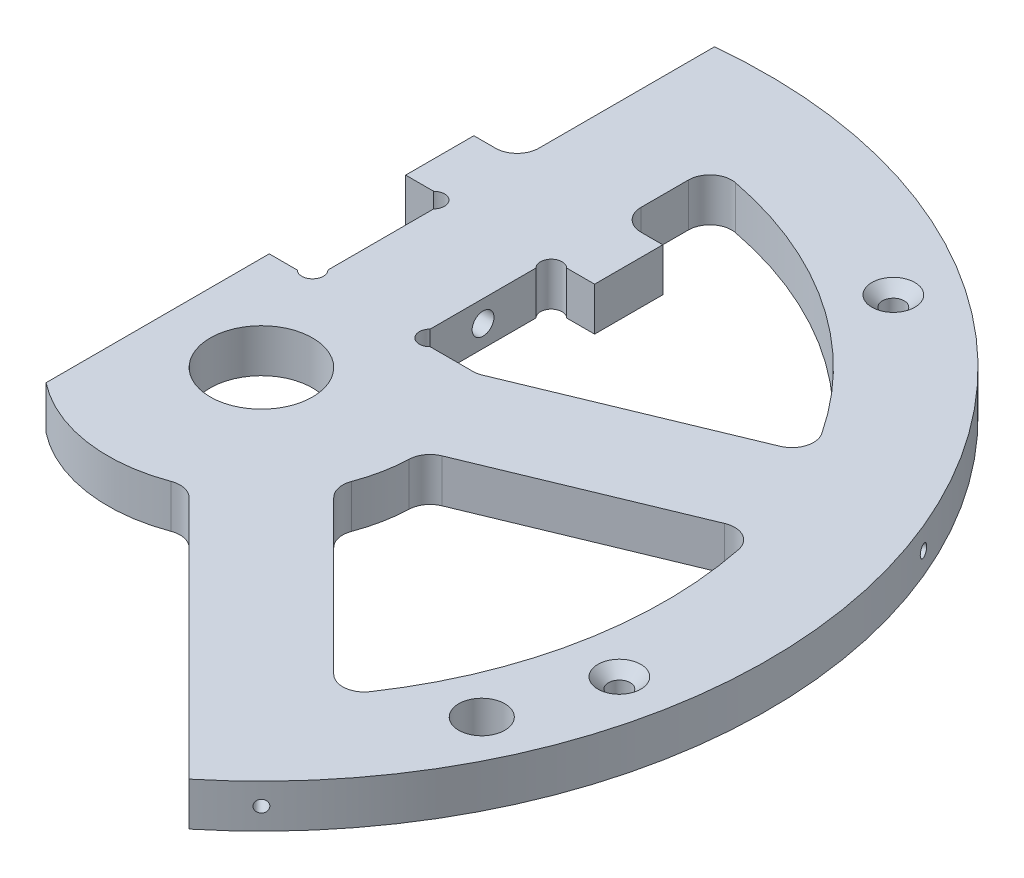
from build123d import *

# Parameters (mm, degrees)
SKETCH1_R                                       = 7.5
BOSS_EXTRUDE1_DEPTH                             = 3.175
CIRPATTERN1_COUNT                               = 3
CIRPATTERN1_ANGLE                               = 135
M3_CLEARANCE_HOLE1_D                            = 3.2
M3_CLEARANCE_HOLE1_DEPTH                        = 15
CSK_FOR_M3_FLAT_HEAD_MACHINE_SCREW1_D           = 3.2
CSK_FOR_M3_FLAT_HEAD_MACHINE_SCREW1_CSINK_D     = 6.3
CSK_FOR_M3_FLAT_HEAD_MACHINE_SCREW1_CSINK_ANGLE = 90
CUT_EXTRUDE1_REACH                              = 107.268
FILLET1_R                                       = 3.175
CUT_EXTRUDE2_REACH                              = 107.268
SKETCH11_W                                      = 9.65
SKETCH11_H                                      = 32.732103654
F_1_4_CLEARANCE_HOLE1_D                         = 6.7564


with BuildPart() as part:
    # Sketch1 → Boss-Extrude1 (new, symmetric)
    with BuildSketch(Plane(origin=(0, 0, 0), x_dir=(1, 0, 0), z_dir=(0, 1, 0))):
        with BuildLine():
            Line((-13.85, 35), (-7.5, 35))
            Line((-7.5, 35), (-7.5, 15))
            Line((-7.5, 15), (-16.770509831, 15))
            ThreePointArc((-16.770509831, 15), (-18.002512666, -13.496649128), (9.696699141, -20.303300859))
            Line((9.696699141, -20.303300859), (46.966384428, -57.572986146))
            ThreePointArc((46.966384428, -57.572986146), (68.644249266, 28.433379025), (-7.5, 73.920497834))
            Line((-7.5, 73.920497834), (-7.5, 45))
            Line((-7.5, 45), (-13.85, 45))
            Line((-13.85, 45), (-13.85, 35))
        make_face()
        with Locations(Location((0, 0, 0), (0, 0, 270))):
            Circle(SKETCH1_R, mode=Mode.SUBTRACT)
        with BuildLine():
            Line((20.303300859, -9.696699141), (46.898012061, -36.291410343))
            ThreePointArc((46.898012061, -36.291410343), (58.160567128, -11.568856096), (57.216234934, 15.581798996))
            Line((57.216234934, 15.581798996), (22.468570216, 1.188845008))
            ThreePointArc((22.468570216, 1.188845008), (22.067668809, -4.389532245), (20.303300859, -9.696699141))
        make_face(mode=Mode.SUBTRACT)
        with BuildLine():
            Line((7.5, 15), (7.5, 35))
            Line((7.5, 35), (13.85, 35))
            Line((13.85, 35), (13.85, 45))
            Line((13.85, 45), (7.5, 45))
            Line((7.5, 45), (7.5, 58.823804705))
            ThreePointArc((7.5, 58.823804705), (32.945314818, 49.30614801), (51.475983449, 29.439991983))
            Line((51.475983449, 29.439991983), (16.72831873, 15.047037996))
            Line((16.72831873, 15.047037996), (16.614758962, 15))
            Line((16.614758962, 15), (7.5, 15))
        make_face(mode=Mode.SUBTRACT)
    extrude(amount=BOSS_EXTRUDE1_DEPTH, both=True)

    # Sketch5 → M2.2x0.45 Tapped Hole1 (revolve, cut)
    with BuildSketch(Plane(origin=(0, 0, -74.3), x_dir=(0, 1, 0), z_dir=(1, 0, 0))):
        Polygon((0, 0), (0, 10.525753042), (0.875, 10), (0.875, 0), align=None)
    m2_2x0_45_tapped_hole1 = revolve(axis=Axis((0, 0, -80.65), (0, 0, 1)), mode=Mode.SUBTRACT)

    # CirPattern1: M2.2x0.45 Tapped Hole1 ×3 about axis
    cirpattern1_axis = Axis((0, 3.175, 0), (0, -1, 0))
    for i in range(1, CIRPATTERN1_COUNT):
        add(m2_2x0_45_tapped_hole1.rotate(cirpattern1_axis, i * CIRPATTERN1_ANGLE / (CIRPATTERN1_COUNT - 1)), mode=Mode.SUBTRACT)

    # M3 Clearance Hole1
    with Locations(Plane.ZY.offset(7.5)):
        with Locations((-25, 0)):
            Hole(M3_CLEARANCE_HOLE1_D / 2, depth=M3_CLEARANCE_HOLE1_DEPTH)

    # CSK for M3 Flat Head Machine Screw1 (through all)
    with Locations(Plane(origin=(0, 3.175, 0), x_dir=(1, 0, 0), z_dir=(0, 1, 0))):
        with Locations((65.516456731, -13.032033511), (37.112091566, 55.542170102)):
            CounterSinkHole(CSK_FOR_M3_FLAT_HEAD_MACHINE_SCREW1_D / 2, CSK_FOR_M3_FLAT_HEAD_MACHINE_SCREW1_CSINK_D / 2, counter_sink_angle=CSK_FOR_M3_FLAT_HEAD_MACHINE_SCREW1_CSINK_ANGLE)

    # Sketch10 → Cut-Extrude1 (cut, up to next)
    with BuildSketch(Plane(origin=(0, 3.175, 0), x_dir=(1, 0, 0), z_dir=(0, 1, 0)), mode=Mode.PRIVATE) as cut_extrude1_sk1:
        with BuildLine():
            Line((-8.622532015, 15), (-9.74506403, 15))
            ThreePointArc((-9.74506403, 15), (-8.622532015, 14.535032015), (-7.5, 15))
            Line((-7.5, 15), (-8.622532015, 15))
        make_face()
    cut_extrude1_tool1 = extrude(cut_extrude1_sk1.sketch, amount=-CUT_EXTRUDE1_REACH, mode=Mode.PRIVATE) & part.part
    # Sketch10 → Cut-Extrude1 (cut, up to next)
    with BuildSketch(Plane(origin=(0, 3.175, 0), x_dir=(1, 0, 0), z_dir=(0, 1, 0)), mode=Mode.PRIVATE) as cut_extrude1_sk2:
        with BuildLine():
            ThreePointArc((-7.035032015, 16.122532015), (-7.155873257, 16.730041964), (-7.5, 17.24506403))
            Line((-7.5, 17.24506403), (-7.5, 16.122532015))
            Line((-7.5, 16.122532015), (-7.5, 15))
            ThreePointArc((-7.5, 15), (-7.155873257, 15.515022066), (-7.035032015, 16.122532015))
        make_face()
    cut_extrude1_tool2 = extrude(cut_extrude1_sk2.sketch, amount=-CUT_EXTRUDE1_REACH, mode=Mode.PRIVATE) & part.part
    # Sketch10 → Cut-Extrude1 (cut, up to next)
    with BuildSketch(Plane(origin=(0, 3.175, 0), x_dir=(1, 0, 0), z_dir=(0, 1, 0)), mode=Mode.PRIVATE) as cut_extrude1_sk3:
        with BuildLine():
            Line((8.622532015, 15), (7.5, 15))
            ThreePointArc((7.5, 15), (8.622532015, 14.535032015), (9.74506403, 15))
            Line((9.74506403, 15), (8.622532015, 15))
        make_face()
    cut_extrude1_tool3 = extrude(cut_extrude1_sk3.sketch, amount=-CUT_EXTRUDE1_REACH, mode=Mode.PRIVATE) & part.part
    # Sketch10 → Cut-Extrude1 (cut, up to next)
    with BuildSketch(Plane(origin=(0, 3.175, 0), x_dir=(1, 0, 0), z_dir=(0, 1, 0)), mode=Mode.PRIVATE) as cut_extrude1_sk4:
        with BuildLine():
            ThreePointArc((7.5, 17.24506403), (7.035032015, 16.122532015), (7.5, 15))
            Line((7.5, 15), (7.5, 16.122532015))
            Line((7.5, 16.122532015), (7.5, 17.24506403))
        make_face()
    cut_extrude1_tool4 = extrude(cut_extrude1_sk4.sketch, amount=-CUT_EXTRUDE1_REACH, mode=Mode.PRIVATE) & part.part
    # Sketch10 → Cut-Extrude1 (cut, up to next)
    with BuildSketch(Plane(origin=(0, 3.175, 0), x_dir=(1, 0, 0), z_dir=(0, 1, 0)), mode=Mode.PRIVATE) as cut_extrude1_sk5:
        with BuildLine():
            ThreePointArc((7.5, 35), (7.035032015, 33.877467985), (7.5, 32.75493597))
            Line((7.5, 32.75493597), (7.5, 33.877467985))
            Line((7.5, 33.877467985), (7.5, 35))
        make_face()
    cut_extrude1_tool5 = extrude(cut_extrude1_sk5.sketch, amount=-CUT_EXTRUDE1_REACH, mode=Mode.PRIVATE) & part.part
    # Sketch10 → Cut-Extrude1 (cut, up to next)
    with BuildSketch(Plane(origin=(0, 3.175, 0), x_dir=(1, 0, 0), z_dir=(0, 1, 0)), mode=Mode.PRIVATE) as cut_extrude1_sk6:
        with BuildLine():
            ThreePointArc((9.74506403, 35), (8.622532015, 35.464967985), (7.5, 35))
            Line((7.5, 35), (8.622532015, 35))
            Line((8.622532015, 35), (9.74506403, 35))
        make_face()
    cut_extrude1_tool6 = extrude(cut_extrude1_sk6.sketch, amount=-CUT_EXTRUDE1_REACH, mode=Mode.PRIVATE) & part.part
    # Sketch10 → Cut-Extrude1 (cut, up to next)
    with BuildSketch(Plane(origin=(0, 3.175, 0), x_dir=(1, 0, 0), z_dir=(0, 1, 0)), mode=Mode.PRIVATE) as cut_extrude1_sk7:
        with BuildLine():
            ThreePointArc((-7.035032015, 33.877467985), (-7.155873257, 34.484977934), (-7.5, 35))
            Line((-7.5, 35), (-7.5, 33.877467985))
            Line((-7.5, 33.877467985), (-7.5, 32.75493597))
            ThreePointArc((-7.5, 32.75493597), (-7.155873257, 33.269958036), (-7.035032015, 33.877467985))
        make_face()
    cut_extrude1_tool7 = extrude(cut_extrude1_sk7.sketch, amount=-CUT_EXTRUDE1_REACH, mode=Mode.PRIVATE) & part.part
    # Sketch10 → Cut-Extrude1 (cut, up to next)
    with BuildSketch(Plane(origin=(0, 3.175, 0), x_dir=(1, 0, 0), z_dir=(0, 1, 0)), mode=Mode.PRIVATE) as cut_extrude1_sk8:
        with BuildLine():
            Line((-8.622532015, 35), (-7.5, 35))
            ThreePointArc((-7.5, 35), (-8.622532015, 35.464967985), (-9.74506403, 35))
            Line((-9.74506403, 35), (-8.622532015, 35))
        make_face()
    cut_extrude1_tool8 = extrude(cut_extrude1_sk8.sketch, amount=-CUT_EXTRUDE1_REACH, mode=Mode.PRIVATE) & part.part
    add(cut_extrude1_tool1.solids().sort_by_distance((-8.622532, 3.175, -14.811461))[0], mode=Mode.SUBTRACT)
    add(cut_extrude1_tool2.solids().sort_by_distance((-7.311461, 3.175, -16.122532))[0], mode=Mode.SUBTRACT)
    add(cut_extrude1_tool3.solids().sort_by_distance((8.622532, 3.175, -14.811461))[0], mode=Mode.SUBTRACT)
    add(cut_extrude1_tool4.solids().sort_by_distance((7.311461, 3.175, -16.122532))[0], mode=Mode.SUBTRACT)
    add(cut_extrude1_tool5.solids().sort_by_distance((7.311461, 3.175, -33.877468))[0], mode=Mode.SUBTRACT)
    add(cut_extrude1_tool6.solids().sort_by_distance((8.622532, 3.175, -35.188539))[0], mode=Mode.SUBTRACT)
    add(cut_extrude1_tool7.solids().sort_by_distance((-7.311461, 3.175, -33.877468))[0], mode=Mode.SUBTRACT)
    add(cut_extrude1_tool8.solids().sort_by_distance((-8.622532, 3.175, -35.188539))[0], mode=Mode.SUBTRACT)

    # Fillet1
    fillet1_edges = [part.edges().sort_by_distance(p)[0] for p in [
        (-7.5, 0, -45),
        (9.696699141, 0, 20.303300859),
        (7.5, 0, -58.823804705),
        (7.5, 0, -45),
        (16.614758962, 0, -15),
        (51.475983449, 0, -29.439991983),
        (46.898012061, 0, 36.291410343),
        (57.216234934, 0, -15.581798996),
        (22.468570216, 0, -1.188845008),
        (20.303300859, 0, 9.696699141),
    ]]
    fillet(fillet1_edges, radius=FILLET1_R)

    # Sketch11 → Cut-Extrude2 (cut, up to next)
    with BuildSketch(Plane(origin=(0, 3.175, 0), x_dir=(1, 0, 0), z_dir=(0, 1, 0)), mode=Mode.PRIVATE) as cut_extrude2_sk1:
        with Locations((-18.675, -1.366051827)):
            Rectangle(SKETCH11_W, SKETCH11_H)
    cut_extrude2_tool1 = extrude(cut_extrude2_sk1.sketch, amount=-CUT_EXTRUDE2_REACH, mode=Mode.PRIVATE) & part.part
    add(cut_extrude2_tool1.solids().sort_by_distance((-18.675, 3.175, 1.366052))[0], mode=Mode.SUBTRACT)

    # 1/4 Clearance Hole1 (through all)
    with Locations(Plane(origin=(0, 3.175, 0), x_dir=(1, 0, 0), z_dir=(0, 1, 0))):
        with Locations((60.541360174, -28.230899884)):
            Hole(F_1_4_CLEARANCE_HOLE1_D / 2)


solid = part.part
